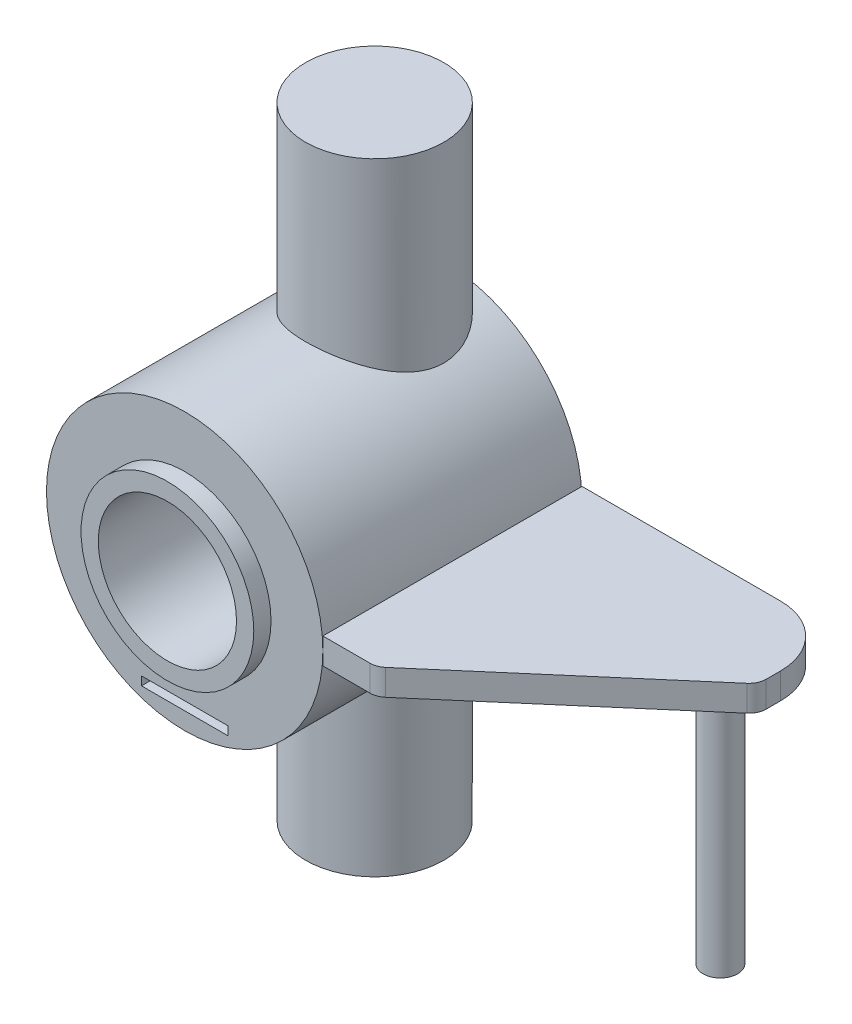
from build123d import *

# Parameters (mm, degrees)
SKETCH1_R                            = 8
BOSS_EXTRUDE1_DEPTH                  = 15
SKETCH2_R                            = 5
SKETCH2_R_2                          = 4
BOSS_EXTRUDE2_DEPTH                  = 1
CUT_EXTRUDE1_START                   = -15
SKETCH3_R                            = 4
CUT_EXTRUDE1_DEPTH                   = 15
SKETCH4_R                            = 4
BOSS_EXTRUDE3_DEPTH                  = 10
BOSS_EXTRUDE3_DIRECTION_2_REACH      = 26
BOSS_EXTRUDE3_DIRECTION_2_END_RADIUS = 8
SKETCH6_R                            = 4
BOSS_EXTRUDE4_DEPTH                  = 10
BOSS_EXTRUDE4_DIRECTION_2_REACH      = 33.559
BOSS_EXTRUDE4_DIRECTION_2_END_RADIUS = 8
SKETCH7_W                            = 15
SKETCH7_H                            = 1.5
BOSS_EXTRUDE5_DEPTH                  = 15
CUT_EXTRUDE2_DEPTH                   = 15
CUT_EXTRUDE3_DEPTH                   = 15
FILLET1_R                            = 1
FILLET2_R                            = 1
SKETCH12_R                           = 1
BOSS_EXTRUDE6_DEPTH                  = 15
SKETCH13_W                           = 5
SKETCH13_H                           = 0.5
CUT_EXTRUDE4_DEPTH                   = 1


with BuildPart() as part:
    # Sketch1 → Boss-Extrude1 (new body)
    with BuildSketch(Plane.XY):
        Circle(SKETCH1_R)
    extrude(amount=BOSS_EXTRUDE1_DEPTH)

    # Sketch2 → Boss-Extrude2 (add)
    with BuildSketch(Plane.XY.offset(15)):
        Circle(SKETCH2_R)
        Circle(SKETCH2_R_2, mode=Mode.SUBTRACT)
    extrude(amount=BOSS_EXTRUDE2_DEPTH)

    # Sketch3 → Cut-Extrude1 (cut)
    with BuildSketch(Plane.XY.offset(15).offset(CUT_EXTRUDE1_START)):
        Circle(SKETCH3_R)
    extrude(amount=CUT_EXTRUDE1_DEPTH, mode=Mode.SUBTRACT)

    # Sketch6 → Boss-Extrude4 (add)
    with BuildSketch(Plane(origin=(0, -8, 0), x_dir=(-1, 0, 0), z_dir=(0, -1, 0))):
        with Locations(Location((0, -4, 0), (0, 0, 270))):
            Circle(SKETCH6_R)
    extrude(amount=BOSS_EXTRUDE4_DEPTH)

    # Boss-Extrude4 direction 2: up to this cylinder (the profile starts outside it)
    boss_extrude4_direction_2_end = Plane(origin=(0, 0, 4), z_dir=(0, 0, -1)) * Cylinder(BOSS_EXTRUDE4_DIRECTION_2_END_RADIUS, 84.118, mode=Mode.PRIVATE)
    # Sketch6 → Boss-Extrude4 direction 2 (add, up to the surface)
    with BuildSketch(Plane(origin=(0, -8, 0), x_dir=(-1, 0, 0), z_dir=(0, -1, 0)), mode=Mode.PRIVATE) as boss_extrude4_direction_2_sk1:
        with Locations(Location((0, -4, 0), (0, 0, 270))):
            Circle(SKETCH6_R)
    boss_extrude4_direction_2_tool1 = extrude(boss_extrude4_direction_2_sk1.sketch, amount=-BOSS_EXTRUDE4_DIRECTION_2_REACH, mode=Mode.PRIVATE) - boss_extrude4_direction_2_end
    add(boss_extrude4_direction_2_tool1.solids().sort_by_distance((0, -8, 4))[0])
    add(boss_extrude4_direction_2_tool1.solids().sort_by_distance((0, -8, 4))[1])

    # Sketch13 → Cut-Extrude4 (cut)
    with BuildSketch(Plane.XY.offset(15)):
        with Locations((0, -6.75)):
            Rectangle(SKETCH13_W, SKETCH13_H)
    extrude(amount=-CUT_EXTRUDE4_DEPTH, mode=Mode.SUBTRACT)


with BuildPart() as body_2:
    # Sketch4 → Boss-Extrude3 (new body)
    with BuildSketch(Plane(origin=(0, 8, 0), x_dir=(1, 0, 0), z_dir=(0, 1, 0))):
        with Locations(Location((0, -4, 0), (0, 0, 270))):
            Circle(SKETCH4_R)
    extrude(amount=BOSS_EXTRUDE3_DEPTH)

    # Boss-Extrude3 direction 2: up to this cylinder (the profile starts outside it)
    boss_extrude3_direction_2_end = Plane(origin=(0, 0, 4), z_dir=(0, 0, -1)) * Cylinder(BOSS_EXTRUDE3_DIRECTION_2_END_RADIUS, 69, mode=Mode.PRIVATE)
    # Sketch4 → Boss-Extrude3 direction 2 (add, up to the surface)
    with BuildSketch(Plane(origin=(0, 8, 0), x_dir=(1, 0, 0), z_dir=(0, 1, 0)), mode=Mode.PRIVATE) as boss_extrude3_direction_2_sk1:
        with Locations(Location((0, -4, 0), (0, 0, 270))):
            Circle(SKETCH4_R)
    boss_extrude3_direction_2_tool1 = extrude(boss_extrude3_direction_2_sk1.sketch, amount=-BOSS_EXTRUDE3_DIRECTION_2_REACH, mode=Mode.PRIVATE) - boss_extrude3_direction_2_end
    add(boss_extrude3_direction_2_tool1.solids().sort_by_distance((0, 8, 4))[0])
    add(boss_extrude3_direction_2_tool1.solids().sort_by_distance((0, 8, 4))[1])


with BuildPart() as body_3:
    # Sketch7 → Boss-Extrude5 (new body)
    with BuildSketch(Plane(origin=(8, 0, 0), x_dir=(0, 0, -1), z_dir=(1, 0, 0))):
        with Locations((-7.5, 0)):
            Rectangle(SKETCH7_W, SKETCH7_H)
    extrude(amount=BOSS_EXTRUDE5_DEPTH)

    # Sketch9 → Cut-Extrude2 (cut)
    with BuildSketch(Plane.XZ.offset(0.75)):
        with BuildLine():
            ThreePointArc((23, 3.5), (21.974873734, 1.025126266), (19.5, 0))
            Line((19.5, 0), (23, 0))
            Line((23, 0), (23, 3.5))
        make_face()
    extrude(amount=-CUT_EXTRUDE2_DEPTH, mode=Mode.SUBTRACT)

    # Sketch11 → Cut-Extrude3 (cut)
    with BuildSketch(Plane(origin=(0, -0.75, 0), x_dir=(-1, 0, 0), z_dir=(0, -1, 0))):
        Polygon((-23, -15), (-11.108053079, -15), (-23, -4.792841708), align=None)
    extrude(amount=-CUT_EXTRUDE3_DEPTH, mode=Mode.SUBTRACT)

    # Fillet1
    fillet1_edges = [body_3.edges().sort_by_distance(p)[0] for p in [
        (11.108053079, 0, 15),
    ]]
    fillet(fillet1_edges, radius=FILLET1_R)

    # Fillet2
    fillet2_edges = [body_3.edges().sort_by_distance(p)[0] for p in [
        (23, 0, 4.792841708),
    ]]
    fillet(fillet2_edges, radius=FILLET2_R)

    # Sketch12 → Boss-Extrude6 (add)
    with BuildSketch(Plane.XZ.offset(0.75)):
        with Locations(Location((19.446318933, 3.434994956, 0), (0, 0, 90))):
            Circle(SKETCH12_R)
    extrude(amount=BOSS_EXTRUDE6_DEPTH)


solid = Compound([part.part, body_2.part, body_3.part])
